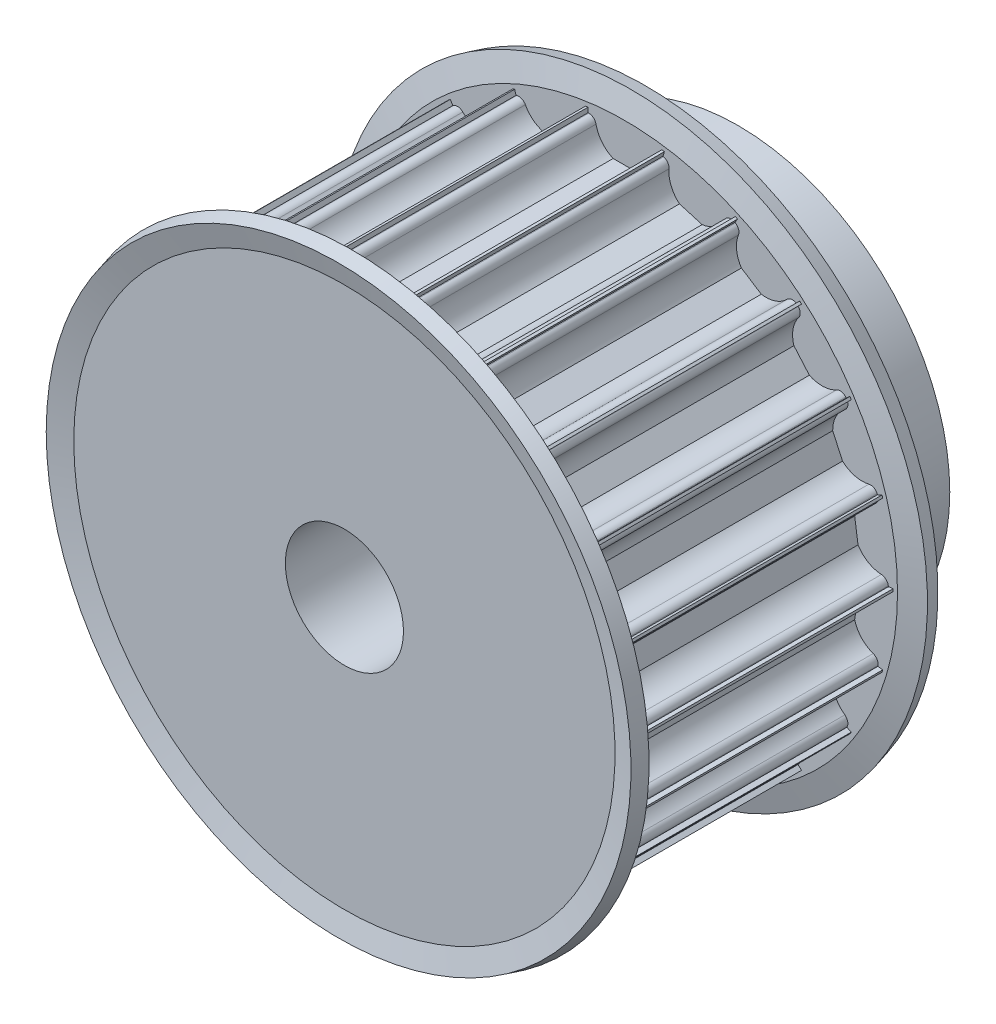
from build123d import *

# Parameters (mm, degrees)
CUT_EXTRUDE1_REACH = 57.544
CIRPATTERN1_COUNT  = 22


with BuildPart() as part:
    # Sketch2 → Revolve1 (revolve)
    with BuildSketch(Plane(origin=(0, 0, 0), x_dir=(0, 0, -1), z_dir=(1, 0, 0)), mode=Mode.PRIVATE) as revolve1_sk:
        Polygon((0, 6), (0, 27.25), (30, 27.25), (30, 21.5), (40, 21.5), (40, 6), align=None)
    revolve(revolve1_sk.sketch.rotate(Axis((0, 0, 0), (0, 0, -1)), 90), axis=Axis((0, 0, 0), (0, 0, -1)))

    # Sketch3 → Cut-Extrude1 (cut, up to next)
    with BuildSketch(Plane.XY, mode=Mode.PRIVATE) as cut_extrude1_sk1:
        with BuildLine():
            Line((-3.674234614, 26.5), (-3.75, 26.5))
            Line((-3.75, 26.5), (-3.75, 28.5))
            Line((-3.75, 28.5), (3.75, 28.5))
            Line((3.75, 28.5), (3.75, 26.5))
            Line((3.75, 26.5), (3.674234614, 26.5))
            ThreePointArc((3.674234614, 26.5), (3.199892965, 26.330947502), (2.939387691, 25.9))
            ThreePointArc((2.939387691, 25.9), (2.331759211, 24.612435701), (1.198957881, 23.75))
            Line((1.198957881, 23.75), (-1.198957881, 23.75))
            ThreePointArc((-1.198957881, 23.75), (-2.331759211, 24.612435701), (-2.939387691, 25.9))
            ThreePointArc((-2.939387691, 25.9), (-3.199892965, 26.330947502), (-3.674234614, 26.5))
        make_face()
    cut_extrude1_tool1 = extrude(cut_extrude1_sk1.sketch, amount=-CUT_EXTRUDE1_REACH, mode=Mode.PRIVATE) & part.part
    cut_extrude1 = cut_extrude1_tool1.solids().sort_by_distance((0, 26.435169, 0))[0]
    add(cut_extrude1, mode=Mode.SUBTRACT)

    # CirPattern1: Cut-Extrude1 ×22 about axis
    cirpattern1_axis = Axis((0, 0, 0), (0, 0, 1))
    for i in range(1, CIRPATTERN1_COUNT):
        add(cut_extrude1.rotate(cirpattern1_axis, i * 360 / CIRPATTERN1_COUNT), mode=Mode.SUBTRACT)

    # Sketch4 → Revolve2 (revolve)
    with BuildSketch(Plane(origin=(0, 0, 0), x_dir=(0, 0, -1), z_dir=(1, 0, 0)), mode=Mode.PRIVATE) as revolve2_sk:
        Polygon((30, 21.5), (30, 27.492521254), (30.591966801, 29.701771432), (29.143078062, 30.09), (28.5, 27.69), (28.5, 21.5), align=None)
        Polygon((1.5, 21.5), (0, 21.5), (0, 27.492521254), (-0.591966801, 29.701771432), (0.856921938, 30.09), (1.5, 27.69), align=None)
    revolve(revolve2_sk.sketch.rotate(Axis((0, 0, 0), (0, 0, 1)), 90), axis=Axis((0, 0, 0), (0, 0, 1)))


solid = part.part
